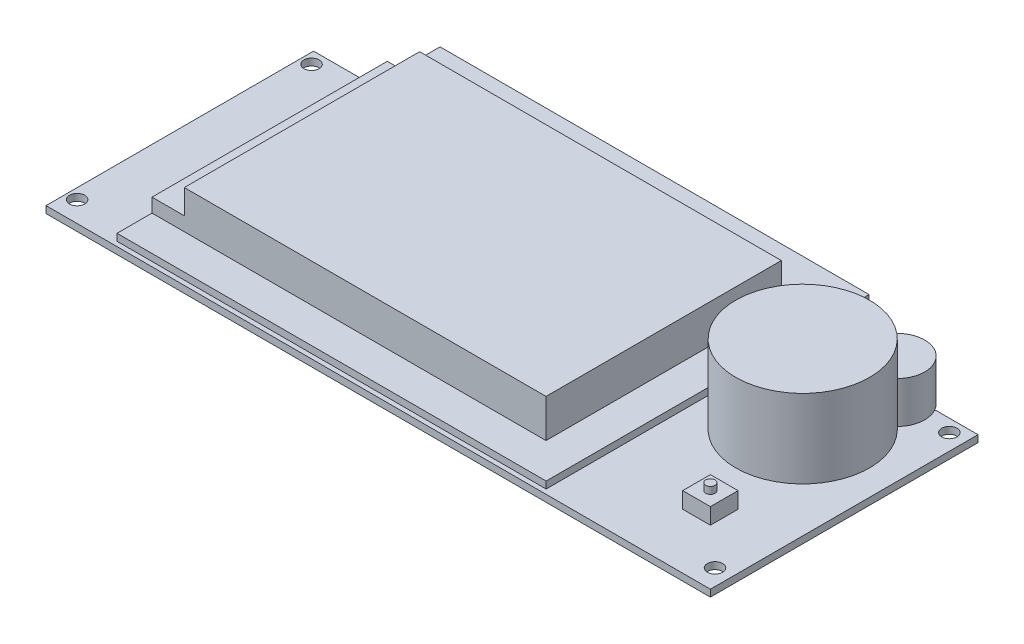
from build123d import *

# Parameters (mm, degrees)
SKETCH1_W            = 144
SKETCH1_H            = 58
BOSS_EXTRUDE2_DEPTH  = 1.5
SKETCH2_W            = 93
SKETCH2_H            = 70
BOSS_EXTRUDE3_DEPTH  = 1.5
SKETCH3_W            = 78.4
SKETCH3_H            = 51
BOSS_EXTRUDE4_DEPTH  = 8.3
SKETCH4_W            = 7
SKETCH4_H            = 51
BOSS_EXTRUDE5_DEPTH  = 3
SKETCH5_R            = 3.5
BOSS_EXTRUDE6_DEPTH  = 7
SKETCH6_R            = 14.5
BOSS_EXTRUDE7_DEPTH  = 17
SKETCH8_R            = 6
BOSS_EXTRUDE8_DEPTH  = 9
SKETCH9_W            = 6
SKETCH9_H            = 6
BOSS_EXTRUDE9_DEPTH  = 3.5
SKETCH10_R           = 1.016941324
BOSS_EXTRUDE10_DEPTH = 1.5
SKETCH11_W           = 20
SKETCH11_H           = 9
BOSS_EXTRUDE11_DEPTH = 9
SKETCH12_R           = 1.65
CUT_EXTRUDE2_DEPTH   = 10


with BuildPart() as part:
    # Sketch1 → Boss-Extrude2 (new body)
    with BuildSketch(Plane(origin=(0, 0, 0), x_dir=(1, 0, 0), z_dir=(0, 1, 0))):
        Rectangle(SKETCH1_W, SKETCH1_H)
    extrude(amount=BOSS_EXTRUDE2_DEPTH)

    # Sketch2 → Boss-Extrude3 (add)
    with BuildSketch(Plane(origin=(0, 1.5, 0), x_dir=(1, 0, 0), z_dir=(0, 1, 0))):
        with Locations((-11.1, 7)):
            Rectangle(SKETCH2_W, SKETCH2_H)
    extrude(amount=BOSS_EXTRUDE3_DEPTH)

    # Sketch3 → Boss-Extrude4 (add)
    with BuildSketch(Plane(origin=(0, 3, 0), x_dir=(1, 0, 0), z_dir=(0, 1, 0))):
        with Locations((-11.4, 5.076084889)):
            Rectangle(SKETCH3_W, SKETCH3_H)
    extrude(amount=BOSS_EXTRUDE4_DEPTH)

    # Sketch4 → Boss-Extrude5 (add)
    with BuildSketch(Plane(origin=(0, 3, 0), x_dir=(1, 0, 0), z_dir=(0, 1, 0))):
        with Locations((-54.1, 5.076084889)):
            Rectangle(SKETCH4_W, SKETCH4_H)
    extrude(amount=BOSS_EXTRUDE5_DEPTH)

    # Sketch5 → Boss-Extrude6 (add)
    with BuildSketch(Plane(origin=(0, 1.5, 0), x_dir=(1, 0, 0), z_dir=(0, 1, 0))):
        with Locations(Location((59, 4, 0), (0, 0, 90))):
            Circle(SKETCH5_R)
    extrude(amount=BOSS_EXTRUDE6_DEPTH)

    # Sketch6 → Boss-Extrude7 (add)
    with BuildSketch(Plane(origin=(0, 8.5, 0), x_dir=(1, 0, 0), z_dir=(0, 1, 0))):
        with Locations(Location((59, 4, 0), (0, 0, 270))):
            Circle(SKETCH6_R)
    extrude(amount=BOSS_EXTRUDE7_DEPTH)

    # Sketch8 → Boss-Extrude8 (add)
    with BuildSketch(Plane(origin=(0, 1.5, 0), x_dir=(1, 0, 0), z_dir=(0, 1, 0))):
        with Locations(Location((57.45, 26, 0), (0, 0, 150))):
            Circle(SKETCH8_R)
    extrude(amount=BOSS_EXTRUDE8_DEPTH)

    # Sketch9 → Boss-Extrude9 (add)
    with BuildSketch(Plane(origin=(0, 1.5, 0), x_dir=(1, 0, 0), z_dir=(0, 1, 0))):
        with Locations((57, -14)):
            Rectangle(SKETCH9_W, SKETCH9_H)
    extrude(amount=BOSS_EXTRUDE9_DEPTH)

    # Sketch10 → Boss-Extrude10 (add)
    with BuildSketch(Plane(origin=(0, 5, 0), x_dir=(1, 0, 0), z_dir=(0, 1, 0))):
        with Locations(Location((57, -14, 0), (0, 0, 270))):
            Circle(SKETCH10_R)
    extrude(amount=BOSS_EXTRUDE10_DEPTH)

    # Sketch11 → Boss-Extrude11 (add)
    with BuildSketch(Plane.XZ):
        with Locations((6, -2)):
            Rectangle(SKETCH11_W, SKETCH11_H)
        with Locations((-15.8, -2)):
            Rectangle(SKETCH11_W, SKETCH11_H)
    extrude(amount=BOSS_EXTRUDE11_DEPTH)

    # Sketch12 → Cut-Extrude2 (cut)
    with BuildSketch(Plane(origin=(0, 0, 0), x_dir=(1, 0, 0), z_dir=(0, 1, 0))):
        with Locations(Location((68.5, 26.3, 0), (0, 0, 90))):
            Circle(SKETCH12_R)
        with Locations(Location((68.5, -24.5, 0), (0, 0, 90))):
            Circle(SKETCH12_R)
        with Locations(Location((-69.75, 26.3, 0), (0, 0, 90))):
            Circle(SKETCH12_R)
        with Locations(Location((-69.75, -24.5, 0), (0, 0, 90))):
            Circle(SKETCH12_R)
    extrude(amount=CUT_EXTRUDE2_DEPTH, mode=Mode.SUBTRACT)


solid = part.part
